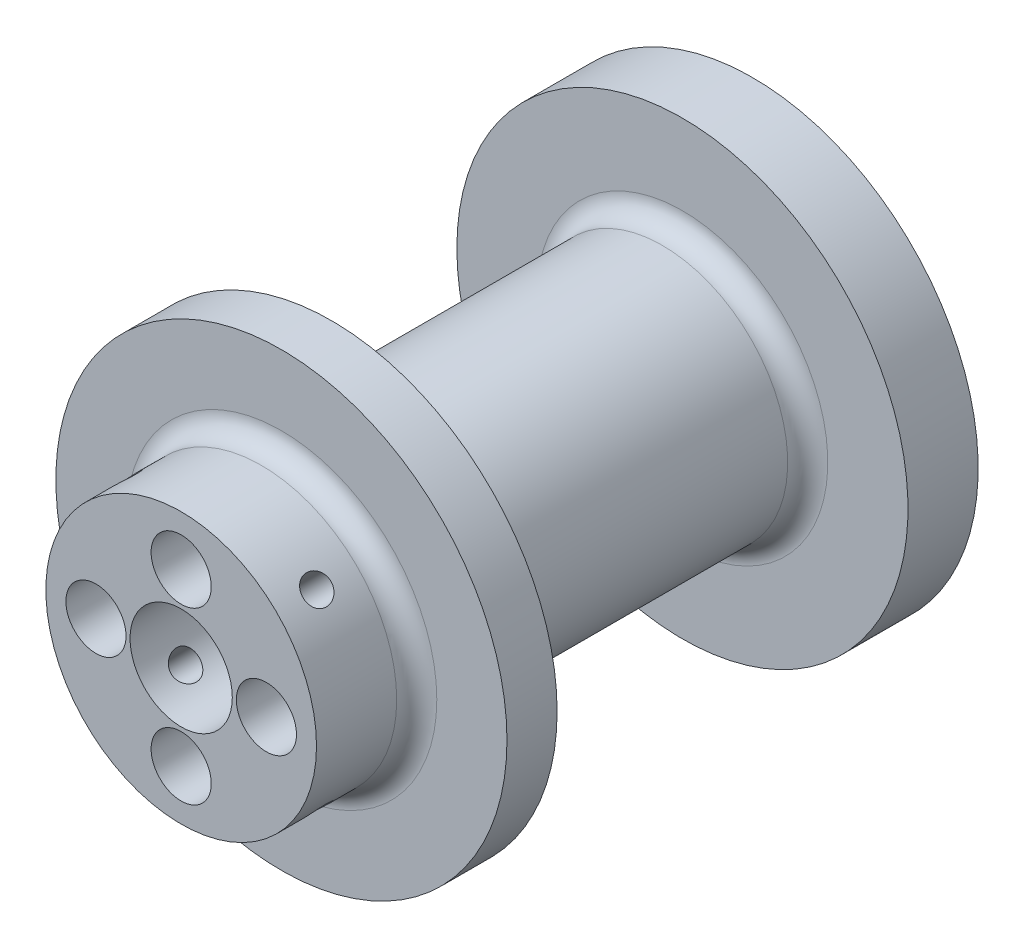
from build123d import *
from build123d.topology import SkipClean

# Parameters (mm, degrees)
SKETCH_1_R               = 12.5
SKETCH_1_R_2             = 5.1
EXTRUDE_1_DEPTH          = 35
EXTRUDE_START            = 7
SKETCH_2_R               = 22.5
SKETCH_2_R_2             = 5.1
EXTRUDE_2_DEPTH          = 7
SKETCH_3_R               = 1.4
CUT_EXTRUDE_1_DEPTH      = 20
FILLET_1_R               = 2
SKETCH_4_R               = 22.5
SKETCH_4_R_2             = 5.1
SKETCH_4_R_3             = 1.55
EXTRUDE_3_DEPTH          = 5
SKETCH_5_R               = 13.5
SKETCH_5_R_2             = 5.1
SKETCH_5_R_3             = 3
EXTRUDE_4_DEPTH          = 10
FILLET_2_R               = 2
SKETCH_6_R               = 1.4
CUT_EXTRUDE_2_DEPTH      = 68.482477275
PATTERN_CIRCULAR_1_COUNT = 2
PATTERN_CIRCULAR_1_ANGLE = 90


with BuildPart() as part:
    # Эскиз1 → Бобышка-Вытянуть1 (new body)
    with BuildSketch(Plane.XY):
        Circle(SKETCH_1_R)
        Circle(SKETCH_1_R_2, mode=Mode.SUBTRACT)
    extrude(amount=EXTRUDE_1_DEPTH)

    # Эскиз2 → Бобышка-Вытянуть2 (add)
    with SkipClean():  # the faces are left unmerged after this step: merging them gives an invalid solid
        with BuildSketch(Plane(origin=(0, 0, 0), x_dir=(-1, 0, 0), z_dir=(0, 0, -1)).offset(EXTRUDE_START)):
            Circle(SKETCH_2_R)
            Circle(SKETCH_2_R_2, mode=Mode.SUBTRACT)
        extrude(amount=-EXTRUDE_2_DEPTH)

    # Эскиз3 → Вырез-Вытянуть1 (cut)
    with SkipClean():  # the faces are left unmerged after this step: merging them gives an invalid solid
        with BuildSketch(Plane.XY.offset(35)):
            with Locations((0, 8.5)):
                Circle(SKETCH_3_R)
            with Locations((8.5, 0)):
                Circle(SKETCH_3_R)
            with Locations((0, -8.5)):
                Circle(SKETCH_3_R)
            with Locations((-8.5, 0)):
                Circle(SKETCH_3_R)
        extrude(amount=-CUT_EXTRUDE_1_DEPTH, mode=Mode.SUBTRACT)

    # Скругление1
    fillet_1_edges = [part.edges().sort_by_distance(p)[0] for p in [
        (-12.5, 0, 0),
    ]]
    fillet(fillet_1_edges, radius=FILLET_1_R)


with BuildPart() as body_2:
    # Эскиз4 → Бобышка-Вытянуть3 (new body)
    with BuildSketch(Plane.XY.offset(35)):
        Circle(SKETCH_4_R)
        Circle(SKETCH_4_R_2, mode=Mode.SUBTRACT)
        with Locations((0, 8.5)):
            Circle(SKETCH_4_R_3, mode=Mode.SUBTRACT)
        with Locations((8.5, 0)):
            Circle(SKETCH_4_R_3, mode=Mode.SUBTRACT)
        with Locations((0, -8.5)):
            Circle(SKETCH_4_R_3, mode=Mode.SUBTRACT)
        with Locations((-8.5, 0)):
            Circle(SKETCH_4_R_3, mode=Mode.SUBTRACT)
    extrude(amount=EXTRUDE_3_DEPTH)

    # Эскиз5 → Бобышка-Вытянуть4 (add)
    with BuildSketch(Plane.XY.offset(40)):
        Circle(SKETCH_5_R)
        Circle(SKETCH_5_R_2, mode=Mode.SUBTRACT)
        with Locations((0, 8.5)):
            Circle(SKETCH_5_R_3, mode=Mode.SUBTRACT)
        with Locations((8.5, 0)):
            Circle(SKETCH_5_R_3, mode=Mode.SUBTRACT)
        with Locations((0, -8.5)):
            Circle(SKETCH_5_R_3, mode=Mode.SUBTRACT)
        with Locations((-8.5, 0)):
            Circle(SKETCH_5_R_3, mode=Mode.SUBTRACT)
    extrude(amount=EXTRUDE_4_DEPTH)

    # Скругление2
    fillet_2_edges = [body_2.edges().sort_by_distance(p)[0] for p in [
        (-13.5, 0, 40),
    ]]
    fillet(fillet_2_edges, radius=FILLET_2_R)

    # Эскиз6 → Вырез-Вытянуть2 (cut, through all)
    with BuildSketch(Plane(origin=(9.545941546, 9.545941546, 0), x_dir=(0, 0, -1), z_dir=(0.7071067811865488, 0.7071067811865464, 0))):
        with Locations(Location((-46, 0, 0), (0, 0, 90))):
            Circle(SKETCH_6_R)
    cut_extrude_2 = extrude(amount=-CUT_EXTRUDE_2_DEPTH, mode=Mode.SUBTRACT)

    # Круговой массив1: Вырез-Вытянуть2 ×2 about axis
    pattern_circular_1_axis = Axis((0, 0, 40), (0, 0, -1))
    for i in range(1, PATTERN_CIRCULAR_1_COUNT):
        add(cut_extrude_2.rotate(pattern_circular_1_axis, i * PATTERN_CIRCULAR_1_ANGLE / (PATTERN_CIRCULAR_1_COUNT - 1)), mode=Mode.SUBTRACT)


solid = Compound([part.part, body_2.part])
